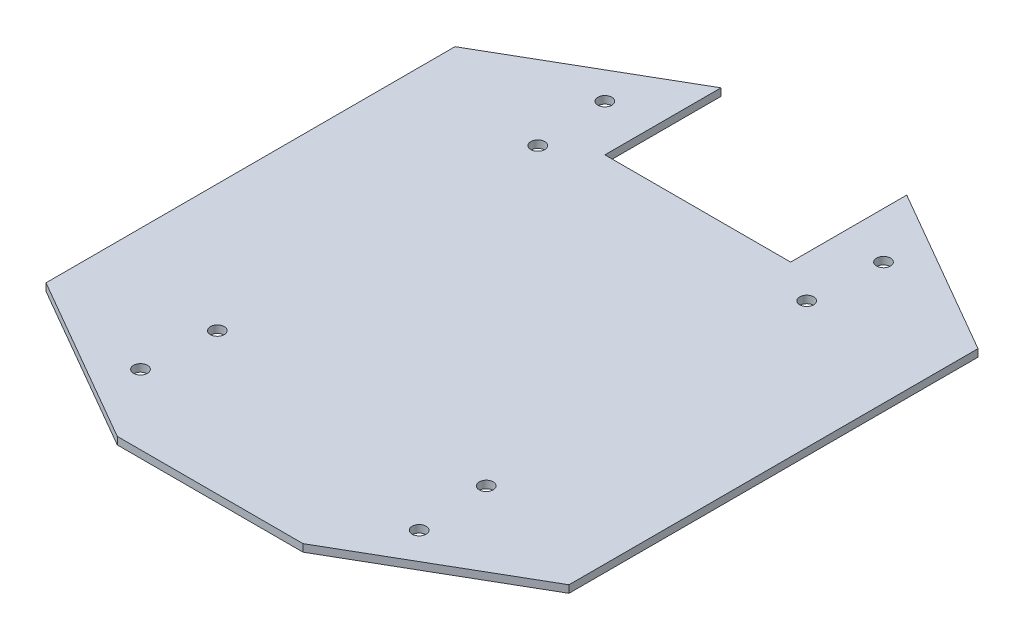
from build123d import *

# Parameters (mm, degrees)
BOSS_EXTRUDE1_DEPTH = 1.6
CUT_EXTRUDE1_DEPTH  = 1.6
SKETCH5_R           = 1.5
CUT_EXTRUDE2_DEPTH  = 1.6
BOSS_EXTRUDE2_DEPTH = 1.6
SKETCH10_R          = 1.5
CUT_EXTRUDE5_DEPTH  = 1.6
CUT_EXTRUDE6_DEPTH  = 1.6
SKETCH14_W          = 40
SKETCH14_H          = 25
CUT_EXTRUDE7_DEPTH  = 1.6
CUT_EXTRUDE10_DEPTH = 1.6


with BuildPart() as part:
    # Sketch3 → Boss-Extrude1 (new body)
    with BuildSketch(Plane(origin=(0, 0, 0), x_dir=(1, 0, 0), z_dir=(0, 1, 0))):
        Polygon((-20, 65), (20, 65), (65, 39.019237886), (65, -39.019237886), (20, -65), (-20, -65), (-65, -39.019237886), (-65, 39.019237886), align=None)
    extrude(amount=BOSS_EXTRUDE1_DEPTH)

    # Sketch4 → Cut-Extrude1 (cut)
    with BuildSketch(Plane(origin=(0, 1.6, 0), x_dir=(1, 0, 0), z_dir=(0, 1, 0))):
        Polygon((-61.579798567, 40.993892105), (-65, 31.596965897), (-65, 39.019237886), align=None)
        Polygon((65, 31.596965897), (61.579798567, 40.993892105), (65, 39.019237886), align=None)
        Polygon((61.579798567, -40.993892105), (65, -39.019237886), (65, -31.596965897), align=None)
        Polygon((-61.579798567, -40.993892105), (-65, -39.019237886), (-65, -31.596965897), align=None)
    extrude(amount=-CUT_EXTRUDE1_DEPTH, mode=Mode.SUBTRACT)

    # Sketch5 → Cut-Extrude2 (cut)
    with BuildSketch(Plane(origin=(0, 1.6, 0), x_dir=(1, 0, 0), z_dir=(0, 1, 0))):
        with Locations(Location((-30, 50, 0), (0, 0, 270))):
            Circle(SKETCH5_R)
        with Locations(Location((30, 50, 0), (0, 0, 270))):
            Circle(SKETCH5_R)
        with Locations(Location((30, -50, 0), (0, 0, 270))):
            Circle(SKETCH5_R)
        with Locations(Location((-30, -50, 0), (0, 0, 270))):
            Circle(SKETCH5_R)
    extrude(amount=-CUT_EXTRUDE2_DEPTH, mode=Mode.SUBTRACT)

    # Sketch6 → Boss-Extrude2 (add)
    with BuildSketch(Plane(origin=(0, 1.6, 0), x_dir=(1, 0, 0), z_dir=(0, 1, 0))):
        Polygon((-65, 31.596965897), (-76.50035508, 0), (-65, -31.596965897), align=None)
        Polygon((65, 31.596965897), (65, -31.596965897), (76.50035508, 0), align=None)
    extrude(amount=-BOSS_EXTRUDE2_DEPTH)

    # Sketch10 → Cut-Extrude5 (cut)
    with BuildSketch(Plane(origin=(0, 1.6, 0), x_dir=(1, 0, 0), z_dir=(0, 1, 0))):
        with Locations(Location((-28.953010595, 34.50485439, 0), (0, 0, 270))):
            Circle(SKETCH10_R)
        with Locations(Location((28.953010595, 34.50485439, 0), (0, 0, 270))):
            Circle(SKETCH10_R)
        with Locations(Location((-28.953010595, -34.50485439, 0), (0, 0, 270))):
            Circle(SKETCH10_R)
        with Locations(Location((28.953010595, -34.50485439, 0), (0, 0, 270))):
            Circle(SKETCH10_R)
    extrude(amount=-CUT_EXTRUDE5_DEPTH, mode=Mode.SUBTRACT)

    # Sketch11 → Cut-Extrude6 (cut)
    with BuildSketch(Plane(origin=(0, 1.6, 0), x_dir=(1, 0, 0), z_dir=(0, 1, 0))):
        Polygon((-68.311024809, 22.5), (-68.311024809, -22.5), (-76.50035508, 0), align=None)
        Polygon((68.311024809, 22.5), (68.311024809, -22.5), (76.50035508, 0), align=None)
    extrude(amount=-CUT_EXTRUDE6_DEPTH, mode=Mode.SUBTRACT)

    # Sketch14 → Cut-Extrude7 (cut)
    with BuildSketch(Plane(origin=(0, 1.6, 0), x_dir=(1, 0, 0), z_dir=(0, 1, 0))):
        with Locations((0, 52.5)):
            Rectangle(SKETCH14_W, SKETCH14_H)
    extrude(amount=-CUT_EXTRUDE7_DEPTH, mode=Mode.SUBTRACT)

    # Sketch17 → Cut-Extrude10 (cut)
    with BuildSketch(Plane(origin=(0, 1.6, 0), x_dir=(1, 0, 0), z_dir=(0, 1, 0))):
        Polygon((-56.311024809, 44.035820052), (-56.311024809, -44.035820052), (-61.579798567, -40.993892105), (-68.311024809, -22.5), (-68.311024809, 22.5), (-61.579798567, 40.993892105), align=None)
        Polygon((68.311024809, 22.5), (61.579798567, 40.993892105), (56.311024809, 44.035820052), (56.311024809, -44.035820052), (61.579798567, -40.993892105), (68.311024809, -22.5), align=None)
    extrude(amount=-CUT_EXTRUDE10_DEPTH, mode=Mode.SUBTRACT)


solid = part.part
